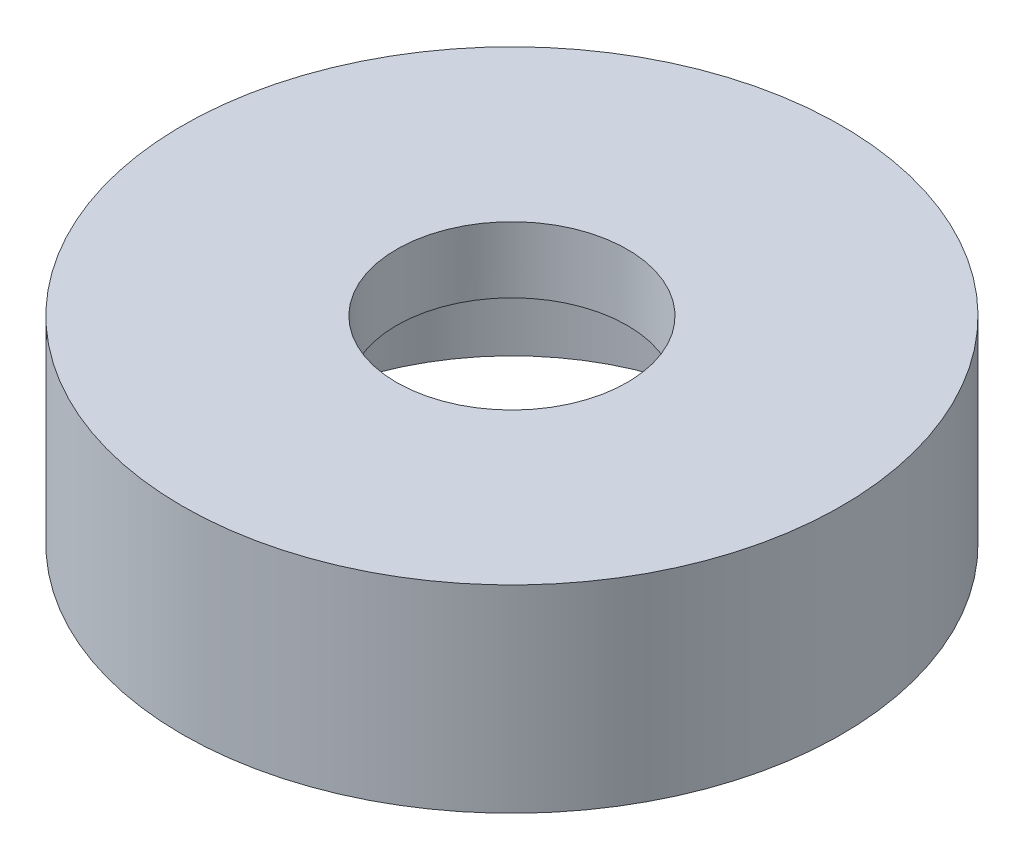
from build123d import *

# Parameters (mm, degrees)
SKETCH_1_R          = 20
EXTRUDE_1_DEPTH     = 12
SKETCH_3_R          = 14
CUT_EXTRUDE_3_DEPTH = 8
SKETCH_4_R          = 7
CUT_EXTRUDE_4_DEPTH = 31.724582991


with BuildPart() as part:
    # Эскиз1 → Вытянуть1 (new body)
    with BuildSketch(Plane(origin=(0, 0, 0), x_dir=(1, 0, 0), z_dir=(0, 1, 0))):
        with Locations(Location((0, 0, 0), (0, 0, 270))):
            Circle(SKETCH_1_R)
    extrude(amount=EXTRUDE_1_DEPTH)

    # Эскиз3 → Вытянуть3 (cut)
    with BuildSketch(Plane.XZ):
        with Locations(Location((0, 0, 0), (0, 0, 270))):
            Circle(SKETCH_3_R)
    extrude(amount=-CUT_EXTRUDE_3_DEPTH, mode=Mode.SUBTRACT)

    # Эскиз4 → Вытянуть4 (cut, through all)
    with BuildSketch(Plane(origin=(0, 12, 0), x_dir=(1, 0, 0), z_dir=(0, 1, 0))):
        with Locations(Location((0, 0, 0), (0, 0, 270))):
            Circle(SKETCH_4_R)
    extrude(amount=-CUT_EXTRUDE_4_DEPTH, mode=Mode.SUBTRACT)


solid = part.part
